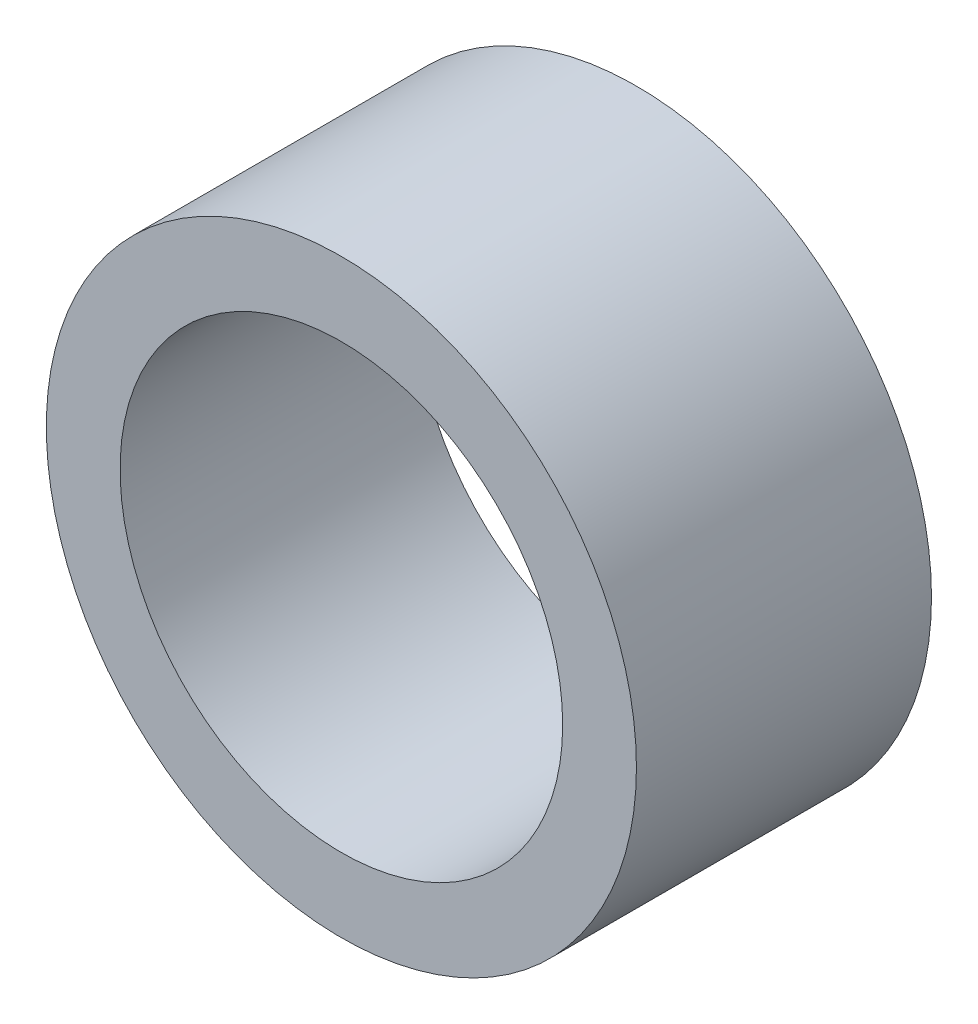
from build123d import *

# Parameters (mm, degrees)
SKETCH_1_R          = 4
EXTRUDE_1_DEPTH     = 4
SKETCH_2_R          = 3
CUT_EXTRUDE_1_DEPTH = 7.92820323


with BuildPart() as part:
    # ｽｹｯﾁ1 → ﾎﾞｽ - 押し出し1 (new body)
    with BuildSketch(Plane.XY):
        Circle(SKETCH_1_R)
    extrude(amount=EXTRUDE_1_DEPTH)

    # ｽｹｯﾁ2 → ｶｯﾄ - 押し出し1 (cut, through all)
    with BuildSketch(Plane.XY.offset(4)):
        Circle(SKETCH_2_R)
    extrude(amount=-CUT_EXTRUDE_1_DEPTH, mode=Mode.SUBTRACT)


solid = part.part
